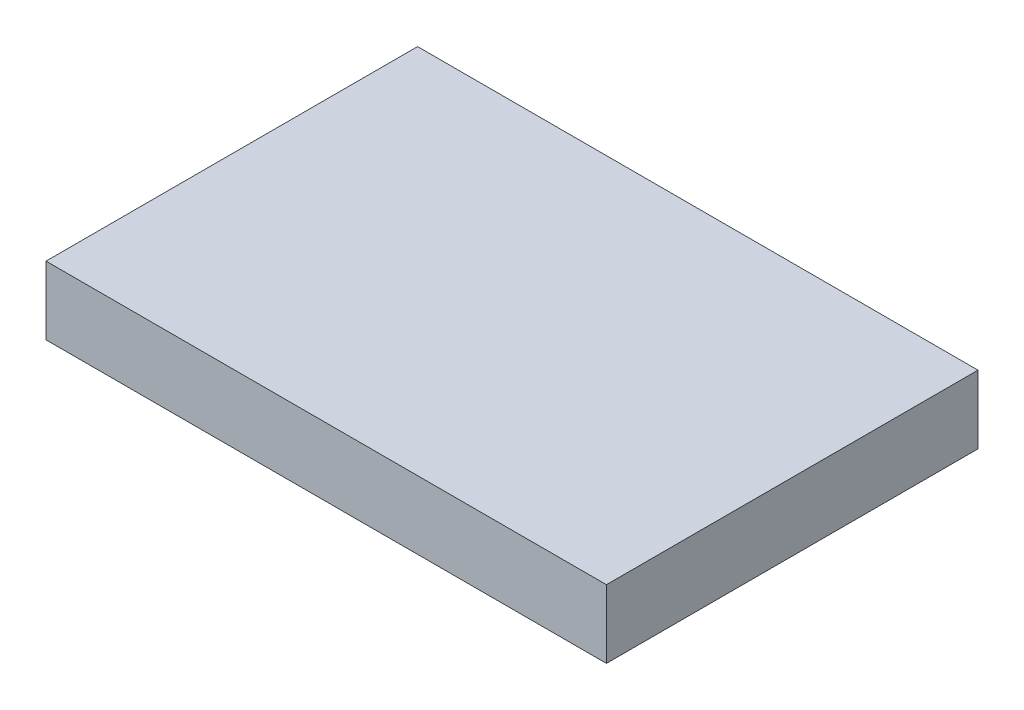
from build123d import *

# Parameters (mm, degrees)
SKETCH1_W           = 82.2
SKETCH1_H           = 54.5
BOSS_EXTRUDE1_DEPTH = 10


with BuildPart() as part:
    # Sketch1 → Boss-Extrude1 (new body)
    with BuildSketch(Plane(origin=(0, 0, 0), x_dir=(1, 0, 0), z_dir=(0, 1, 0))):
        Rectangle(SKETCH1_W, SKETCH1_H)
    extrude(amount=BOSS_EXTRUDE1_DEPTH)


solid = part.part
